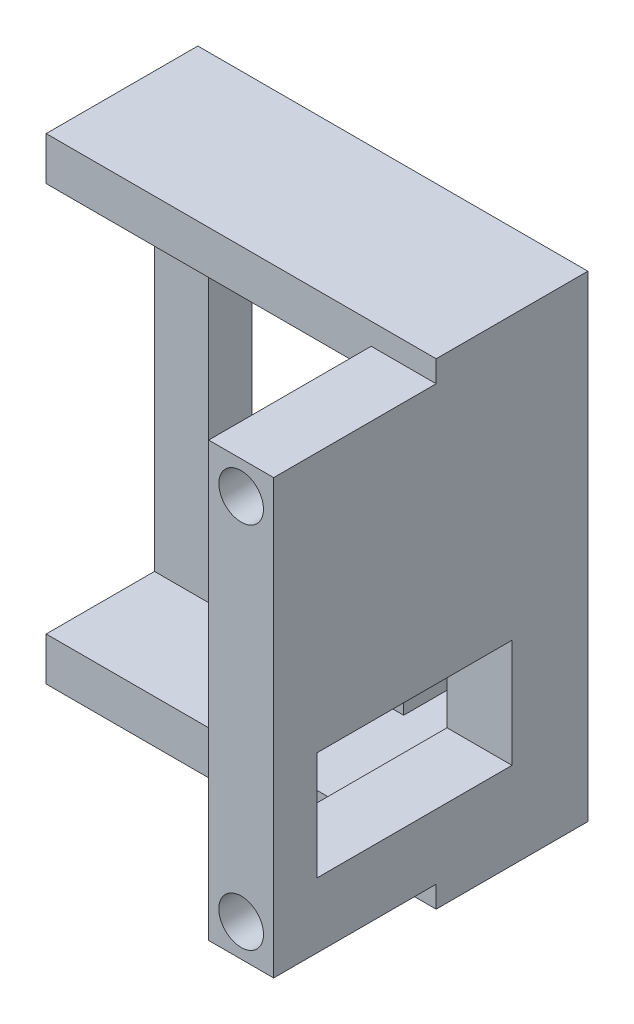
from build123d import *

# Parameters (mm, degrees)
SKETCH1_W           = 40
SKETCH1_H           = 6
SKETCH1_R           = 2.06
BOSS_EXTRUDE1_DEPTH = 25
BOSS_EXTRUDE2_DEPTH = 10
BOSS_EXTRUDE4_START = 4
SKETCH4_W           = 5
SKETCH4_H           = 36
BOSS_EXTRUDE4_DEPTH = 4
SKETCH5_W           = 10
SKETCH5_H           = 18
CUT_EXTRUDE1_DEPTH  = 8


with BuildPart() as part:
    # Sketch1 → Boss-Extrude1 (new body)
    with BuildSketch(Plane(origin=(0, 0, 0), x_dir=(0, 1, 0), z_dir=(0, 0, 1))):
        with Locations((4.5125, -0.675)):
            Rectangle(SKETCH1_W, SKETCH1_H)
        with Locations(Location((-12.4875, -0.675, 0), (0, 0, 270))):
            Circle(SKETCH1_R, mode=Mode.SUBTRACT)
        with Locations(Location((21.5125, -0.675, 0), (0, 0, 90))):
            Circle(SKETCH1_R, mode=Mode.SUBTRACT)
    extrude(amount=BOSS_EXTRUDE1_DEPTH)

    # Sketch2 → Boss-Extrude2 (add)
    with BuildSketch(Plane(origin=(0, 0, 0), x_dir=(1, 0, 0), z_dir=(0, 0, -1))):
        Polygon((-2.325, 15.4875), (3.675, 15.4875), (3.675, 17.4875), (-32.325, 17.4875), (-32.325, 13.4875), (-2.325, 13.4875), align=None)
        Polygon((3.675, -26.5125), (3.675, -24.5125), (-2.325, -24.5125), (-2.325, -22.5125), (-32.325, -22.5125), (-32.325, -26.5125), align=None)
    extrude(amount=-BOSS_EXTRUDE2_DEPTH)

    # Sketch4 → Boss-Extrude4 (add)
    with BuildSketch(Plane(origin=(0, 0, 0), x_dir=(1, 0, 0), z_dir=(0, 0, -1)).offset(BOSS_EXTRUDE4_START)):
        with BuildLine():
            Line((3.675, 17.4875), (-32.325, 17.4875))
            Line((-32.325, 17.4875), (-32.325, 13.4875))
            Line((-32.325, 13.4875), (-27.325, 13.4875))
            Line((-27.325, 13.4875), (-14.325, 13.4875))
            Line((-14.325, 13.4875), (-9.325, 13.4875))
            Line((-9.325, 13.4875), (-2.325, 13.4875))
            Line((-2.325, 13.4875), (-1.125999722, 13.4875))
            ThreePointArc((-1.125999722, 13.4875), (0.675, 14.5475), (2.475999722, 13.4875))
            Line((2.475999722, 13.4875), (3.675, 13.4875))
            Line((3.675, 13.4875), (3.675, 17.4875))
        make_face()
        with BuildLine():
            ThreePointArc((2.735, 12.4875), (2.669199016, 13.003998099), (2.475999722, 13.4875))
            Line((2.475999722, 13.4875), (-1.125999722, 13.4875))
            ThreePointArc((-1.125999722, 13.4875), (0.158501901, 10.493300984), (2.735, 12.4875))
        make_face()
        with BuildLine():
            Line((-1.125999722, 13.4875), (2.475999722, 13.4875))
            ThreePointArc((2.475999722, 13.4875), (0.675, 14.5475), (-1.125999722, 13.4875))
        make_face()
        with BuildLine():
            Line((3.675, -22.5125), (3.675, 13.4875))
            Line((3.675, 13.4875), (2.475999722, 13.4875))
            ThreePointArc((2.475999722, 13.4875), (2.669199016, 13.003998099), (2.735, 12.4875))
            ThreePointArc((2.735, 12.4875), (0.158501901, 10.493300984), (-1.125999722, 13.4875))
            Line((-1.125999722, 13.4875), (-2.325, 13.4875))
            Line((-2.325, 13.4875), (-2.325, -22.5125))
            Line((-2.325, -22.5125), (-1.125999722, -22.5125))
            ThreePointArc((-1.125999722, -22.5125), (0.158501901, -19.518300984), (2.735, -21.5125))
            ThreePointArc((2.735, -21.5125), (2.669199016, -22.028998099), (2.475999722, -22.5125))
            Line((2.475999722, -22.5125), (3.675, -22.5125))
        make_face()
        with BuildLine():
            ThreePointArc((-1.125999722, -22.5125), (0.675, -23.5725), (2.475999722, -22.5125))
            Line((2.475999722, -22.5125), (-1.125999722, -22.5125))
        make_face()
        with BuildLine():
            Line((-1.125999722, -22.5125), (2.475999722, -22.5125))
            ThreePointArc((2.475999722, -22.5125), (2.669199016, -22.028998099), (2.735, -21.5125))
            ThreePointArc((2.735, -21.5125), (0.158501901, -19.518300984), (-1.125999722, -22.5125))
        make_face()
        with BuildLine():
            Line((-27.325, -22.5125), (-32.325, -22.5125))
            Line((-32.325, -22.5125), (-32.325, -26.5125))
            Line((-32.325, -26.5125), (3.675, -26.5125))
            Line((3.675, -26.5125), (3.675, -22.5125))
            Line((3.675, -22.5125), (2.475999722, -22.5125))
            ThreePointArc((2.475999722, -22.5125), (0.675, -23.5725), (-1.125999722, -22.5125))
            Line((-1.125999722, -22.5125), (-2.325, -22.5125))
            Line((-2.325, -22.5125), (-9.325, -22.5125))
            Line((-9.325, -22.5125), (-14.325, -22.5125))
            Line((-14.325, -22.5125), (-27.325, -22.5125))
        make_face()
        with Locations((-29.825, -4.5125)):
            Rectangle(SKETCH4_W, SKETCH4_H)
        with Locations((-11.825, -4.5125)):
            Rectangle(SKETCH4_W, SKETCH4_H)
    extrude(amount=-BOSS_EXTRUDE4_DEPTH)

    # Sketch5 → Cut-Extrude1 (cut)
    with BuildSketch(Plane(origin=(-2.325, 0, 0), x_dir=(0, -1, 0), z_dir=(-1, 0, 0))):
        with Locations((4.4875, 12)):
            Rectangle(SKETCH5_W, SKETCH5_H)
    extrude(amount=-CUT_EXTRUDE1_DEPTH, mode=Mode.SUBTRACT)


solid = part.part
